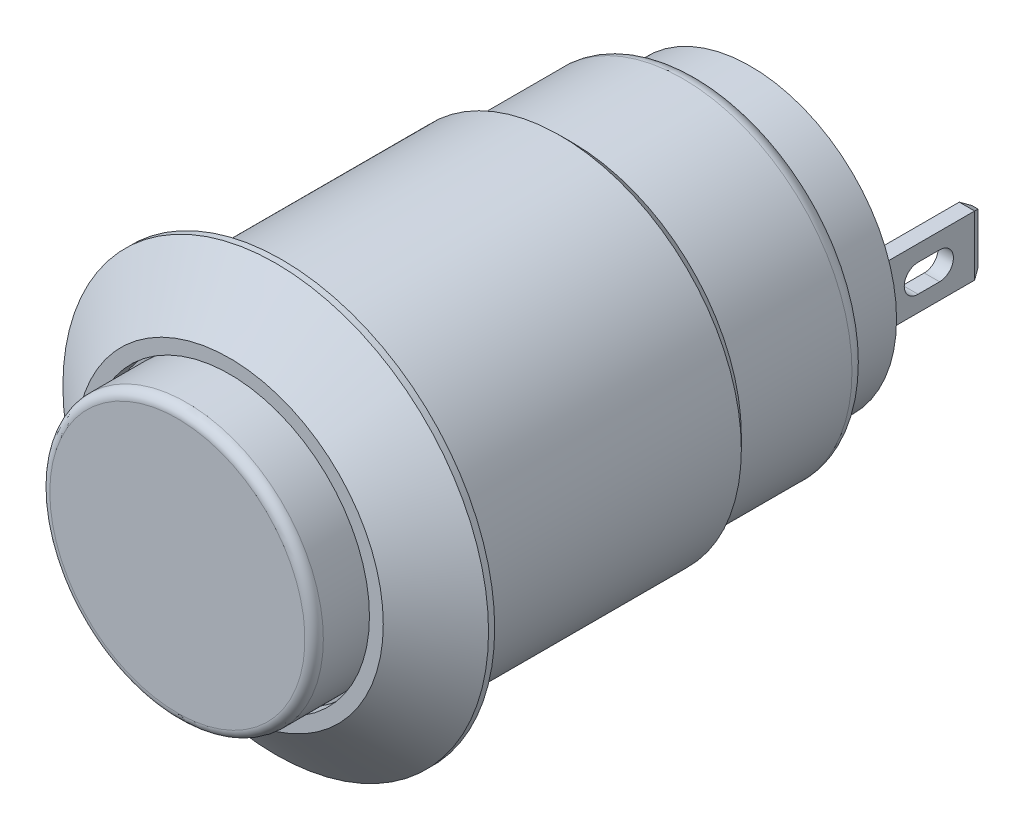
from build123d import *
from OCP.BRepFilletAPI import BRepFilletAPI_MakeChamfer

# Parameters (mm, degrees)
FILLET2_R               = 0.5
FILLET3_R               = 0.3
SKETCH9_W               = 0.5
SKETCH9_H               = 1.95
BOSS_EXTRUDE5_DEPTH     = 3.6
CHAMFER2_SIZE           = 0.15
CHAMFER2_SIZE2          = 0.259807621
CUT_EXTRUDE2_DEPTH      = 25.309951666
CUT_EXTRUDE2_DEPTH_BACK = 25.309951666


with BuildPart() as part:
    # Sketch8 → Revolve1 (revolve)
    with BuildSketch(Plane(origin=(0, 0, 0), x_dir=(0, 0, -1), z_dir=(1, 0, 0)), mode=Mode.PRIVATE) as revolve1_sk:
        Polygon((0, 0), (0, 4.45), (2.2, 4.45), (2.2, 4.55), (1.7, 4.55), (1.7, 5), (3.2, 6.925), (3.4, 6.925), (3.4, 5.9), (12.45, 5.9), (12.85, 5.5), (16.95, 5.5), (16.95, 4.75), (18.65, 4.75), (18.65, 0), align=None)
    revolve(revolve1_sk.sketch.rotate(Axis((0, 0, 0), (0, 0, -1)), 90), axis=Axis((0, 0, 0), (0, 0, -1)))

    # Fillet2
    fillet2_edges = [part.edges().sort_by_distance(p)[0] for p in [
        (-5.5, 0, -16.95),
    ]]
    fillet(fillet2_edges, radius=FILLET2_R)

    # Fillet3
    fillet3_edges = [part.edges().sort_by_distance(p)[0] for p in [
        (-4.45, 0, 0),
    ]]
    fillet(fillet3_edges, radius=FILLET3_R)

    # Sketch9 → Boss-Extrude5 (add)
    with BuildSketch(Plane(origin=(0, 0, -18.65), x_dir=(-1, 0, 0), z_dir=(0, 0, -1))):
        with Locations((-3.7, 0)):
            Rectangle(SKETCH9_W, SKETCH9_H)
        with Locations((3.7, 0)):
            Rectangle(SKETCH9_W, SKETCH9_H)
    extrude(amount=BOSS_EXTRUDE5_DEPTH)

    # Chamfer2: one chamfer whose edges measure the first distance from different faces: ONE call of the kernel's chamfer builder (chamfer() names one face for all edges)
    chamfer2_edges_1 = [part.edges().sort_by_distance(p)[0] for p in [
        (3.45, 0, -22.25),
        (3.7, 0.975, -22.25),
        (3.95, 0, -22.25),
        (3.7, -0.975, -22.25),
    ]]
    chamfer2_side_1 = [part.faces().sort_by_distance(p)[0] for p in [
        (3.7, 0, -22.25),
    ]]
    chamfer2_edges_2 = [part.edges().sort_by_distance(p)[0] for p in [
        (-3.95, 0, -22.25),
        (-3.7, 0.975, -22.25),
        (-3.45, 0, -22.25),
        (-3.7, -0.975, -22.25),
    ]]
    chamfer2_side_2 = [part.faces().sort_by_distance(p)[0] for p in [
        (-3.7, 0, -22.25),
    ]]
    chamfer2 = BRepFilletAPI_MakeChamfer(part.part.solid().wrapped)
    for e in chamfer2_edges_1:
        chamfer2.Add(CHAMFER2_SIZE, CHAMFER2_SIZE2, e.wrapped, chamfer2_side_1[0].wrapped)  # the first distance lies on this face
    for e in chamfer2_edges_2:
        chamfer2.Add(CHAMFER2_SIZE, CHAMFER2_SIZE2, e.wrapped, chamfer2_side_2[0].wrapped)  # the first distance lies on this face
    add(Compound.cast(chamfer2.Shape()), mode=Mode.REPLACE)

    # Sketch10 → Cut-Extrude2 (cut, two sides: drawn at the far end of the back side and taken through both)
    with BuildSketch(Plane(origin=(0, 0, 0), x_dir=(0, 0, -1), z_dir=(1, 0, 0)).offset(-CUT_EXTRUDE2_DEPTH_BACK)):
        with BuildLine():
            Line((20.15, 0.45), (20.85, 0.45))
            ThreePointArc((20.85, 0.45), (21.3, 0), (20.85, -0.45))
            Line((20.85, -0.45), (20.15, -0.45))
            ThreePointArc((20.15, -0.45), (19.7, 0), (20.15, 0.45))
        make_face()
    extrude(amount=CUT_EXTRUDE2_DEPTH + CUT_EXTRUDE2_DEPTH_BACK, mode=Mode.SUBTRACT)


solid = part.part
